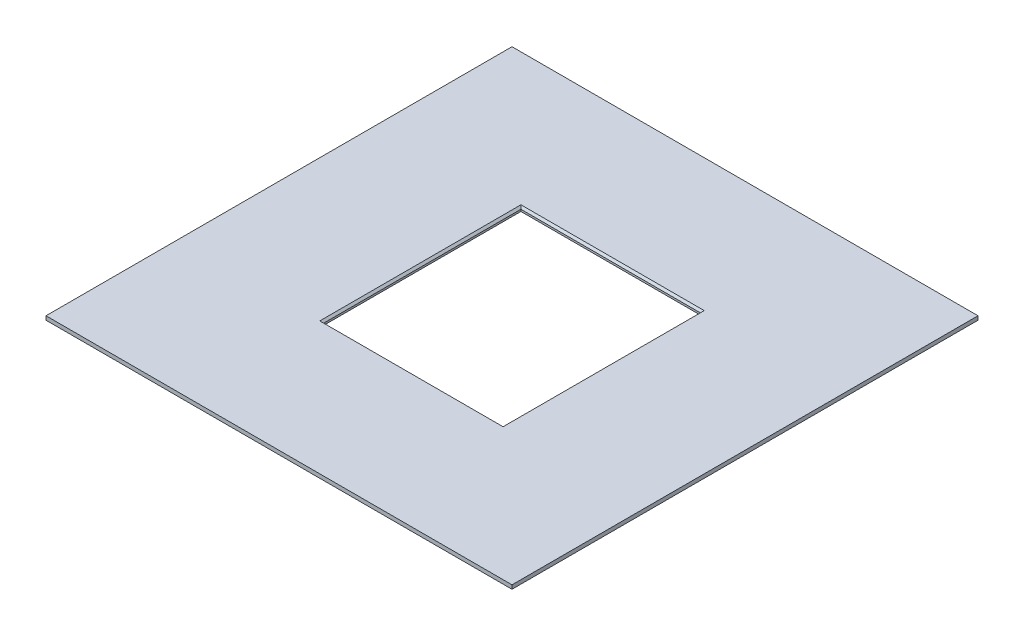
from build123d import *

# Parameters (mm, degrees)
SKETCH1_W           = 120
SKETCH1_H           = 120
SKETCH1_W_2         = 46.2
SKETCH1_H_2         = 50.8
BOSS_EXTRUDE1_DEPTH = 1
CHAMFER1_SIZE       = 0.5


with BuildPart() as part:
    # Sketch1 → Boss-Extrude1 (new body)
    with BuildSketch(Plane(origin=(0, 0, 0), x_dir=(1, 0, 0), z_dir=(0, 1, 0))):
        Rectangle(SKETCH1_W, SKETCH1_H)
        Rectangle(SKETCH1_W_2, SKETCH1_H_2, mode=Mode.SUBTRACT)
    extrude(amount=BOSS_EXTRUDE1_DEPTH)

    # Chamfer1
    chamfer1_edges = [part.edges().sort_by_distance(p)[0] for p in [
        (23.1, 1, 0),
        (0, 1, -25.4),
        (-23.1, 1, 0),
        (0, 1, 25.4),
    ]]
    chamfer(chamfer1_edges, length=CHAMFER1_SIZE)


solid = part.part
